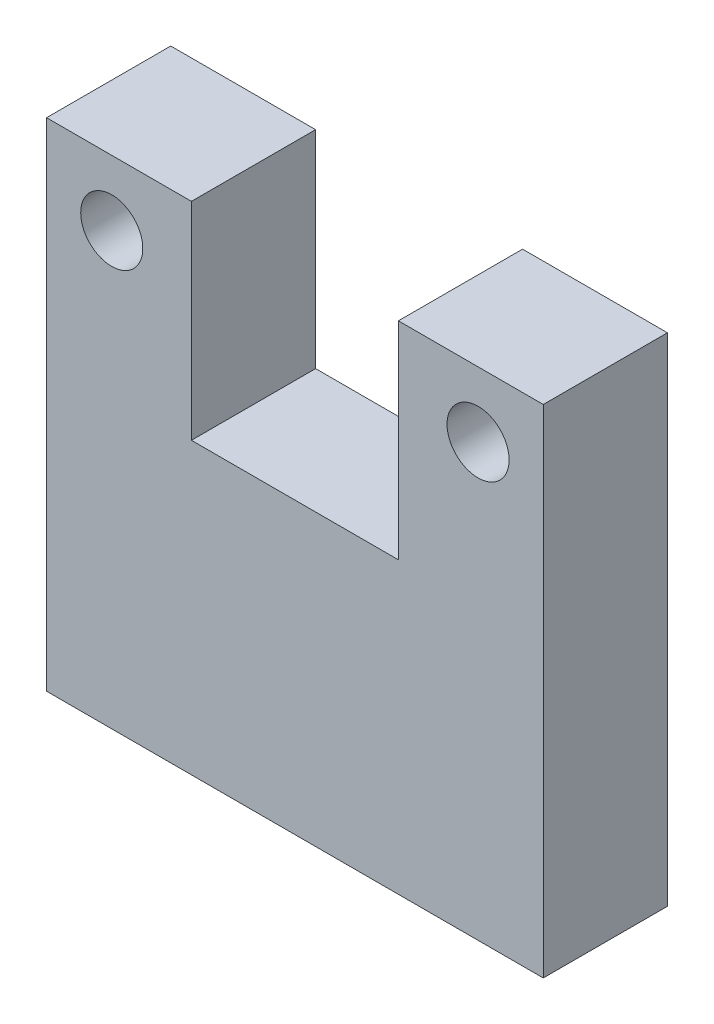
from build123d import *

# Parameters (mm, degrees)
SKETCH1_R           = 38.1
BOSS_EXTRUDE1_DEPTH = 152.4


with BuildPart() as part:
    # Sketch1 → Boss-Extrude1 (new body)
    with BuildSketch(Plane.XY):
        Polygon((304.8, -304.8), (304.8, 304.8), (127, 304.8), (127, 50.8), (-127, 50.8), (-127, 304.8), (-304.8, 304.8), (-304.8, -304.8), align=None)
        with Locations(Location((-224.8, 224.8, 0), (0, 0, 180))):
            Circle(SKETCH1_R, mode=Mode.SUBTRACT)
        with Locations(Location((224.8, 224.8, 0), (0, 0, 180))):
            Circle(SKETCH1_R, mode=Mode.SUBTRACT)
    extrude(amount=BOSS_EXTRUDE1_DEPTH)


solid = part.part
